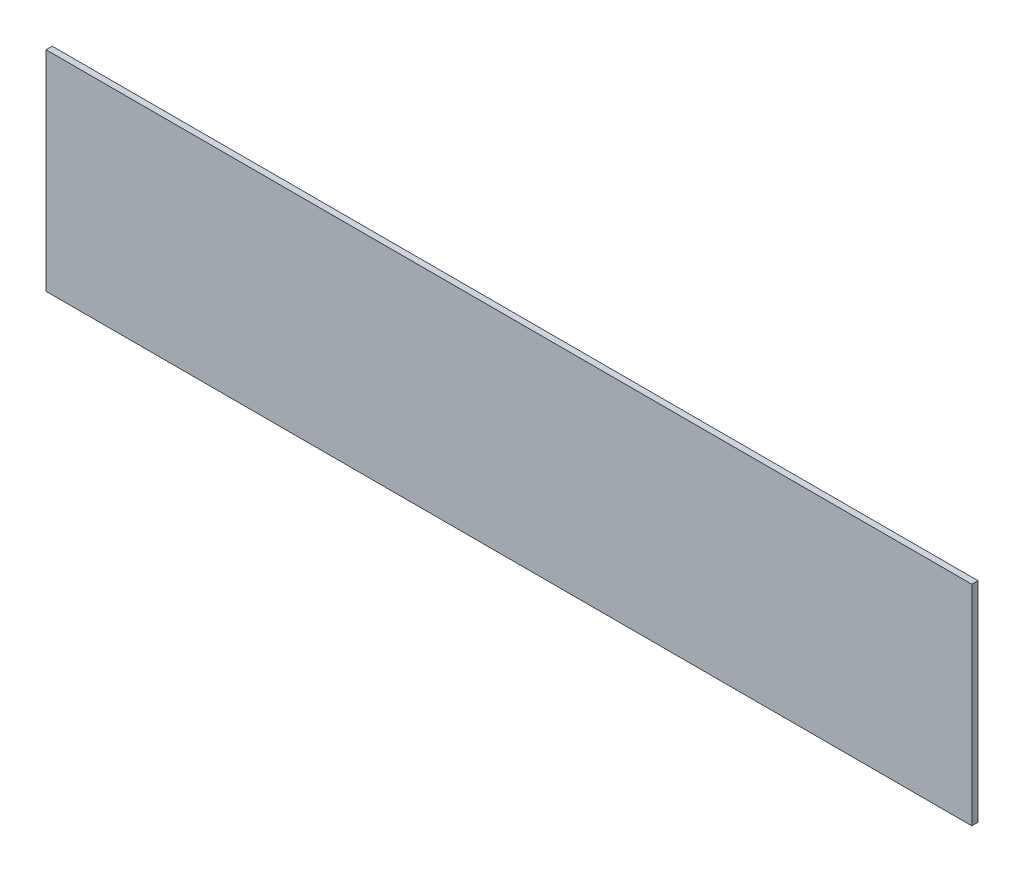
from build123d import *

# Parameters (mm, degrees)
SKETCH1_W           = 190.5
SKETCH1_H           = 43.053
BOSS_EXTRUDE1_DEPTH = 1.27


with BuildPart() as part:
    # Sketch1 → Boss-Extrude1 (new body)
    with BuildSketch(Plane.XY):
        with Locations((48.637415375, -5.09294171)):
            Rectangle(SKETCH1_W, SKETCH1_H)
    extrude(amount=BOSS_EXTRUDE1_DEPTH)


solid = part.part
